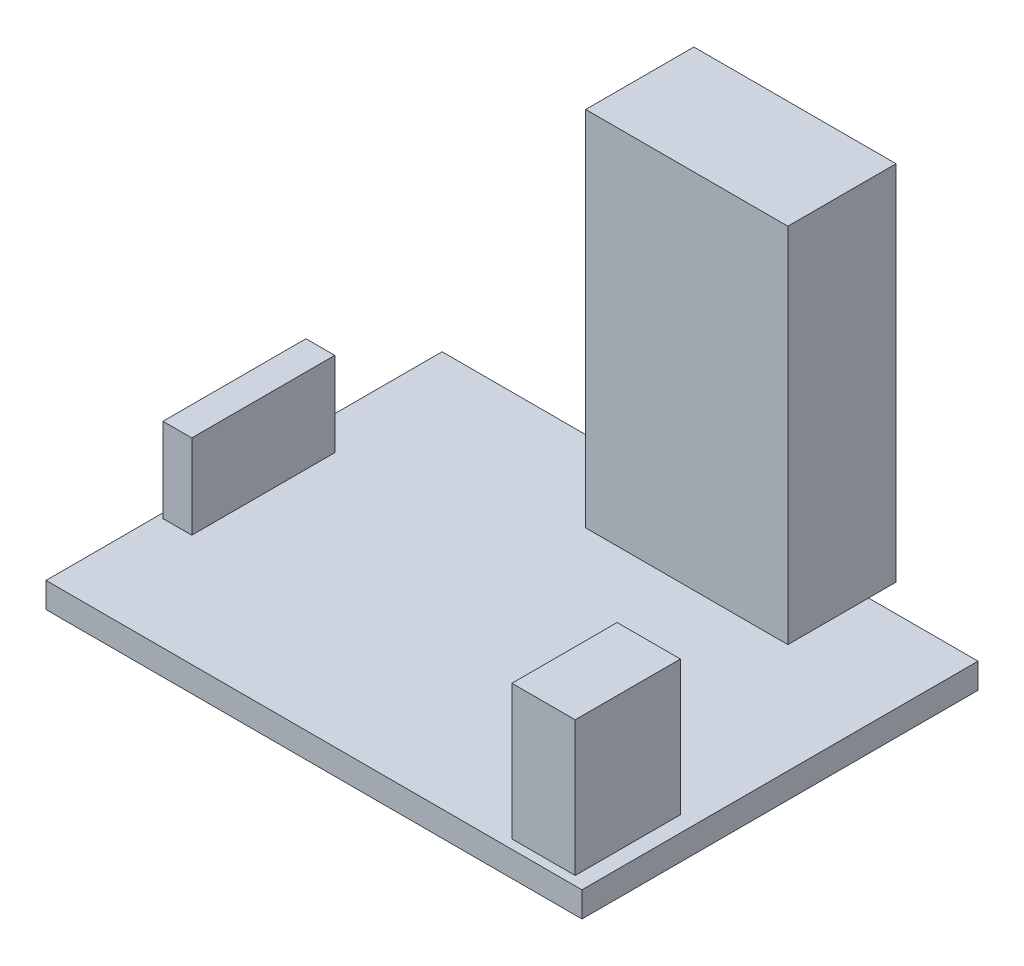
from build123d import *

# Parameters (mm, degrees)
SKETCH1_W           = 31.8
SKETCH1_H           = 23.5
BOSS_EXTRUDE1_DEPTH = 1.5
SKETCH2_W           = 1.710657602
SKETCH2_H           = 8.486639013
BOSS_EXTRUDE2_DEPTH = 5
SKETCH3_W           = 3.754560192
SKETCH3_H           = 6.242789431
BOSS_EXTRUDE3_DEPTH = 8
SKETCH4_W           = 11.996819547
SKETCH4_H           = 6.420520091
BOSS_EXTRUDE4_DEPTH = 21.5


with BuildPart() as part:
    # Sketch1 → Boss-Extrude1 (new body)
    with BuildSketch(Plane(origin=(0, 0, 0), x_dir=(1, 0, 0), z_dir=(0, 1, 0))):
        with Locations((15.9, -11.75)):
            Rectangle(SKETCH1_W, SKETCH1_H)
    extrude(amount=BOSS_EXTRUDE1_DEPTH)

    # Sketch2 → Boss-Extrude2 (add)
    with BuildSketch(Plane(origin=(0, 1.5, 0), x_dir=(1, 0, 0), z_dir=(0, 1, 0))):
        with Locations((1.148381727, -12.610949144)):
            Rectangle(SKETCH2_W, SKETCH2_H)
    extrude(amount=BOSS_EXTRUDE2_DEPTH)

    # Sketch3 → Boss-Extrude3 (add)
    with BuildSketch(Plane(origin=(0, 1.5, 0), x_dir=(1, 0, 0), z_dir=(0, 1, 0))):
        with Locations((28.985446343, -19.842365371)):
            Rectangle(SKETCH3_W, SKETCH3_H)
    extrude(amount=BOSS_EXTRUDE3_DEPTH)

    # Sketch4 → Boss-Extrude4 (add)
    with BuildSketch(Plane(origin=(0, 1.5, 0), x_dir=(1, 0, 0), z_dir=(0, 1, 0))):
        with Locations((19.310233542, -1.58054006)):
            Rectangle(SKETCH4_W, SKETCH4_H)
    extrude(amount=BOSS_EXTRUDE4_DEPTH)


solid = part.part
